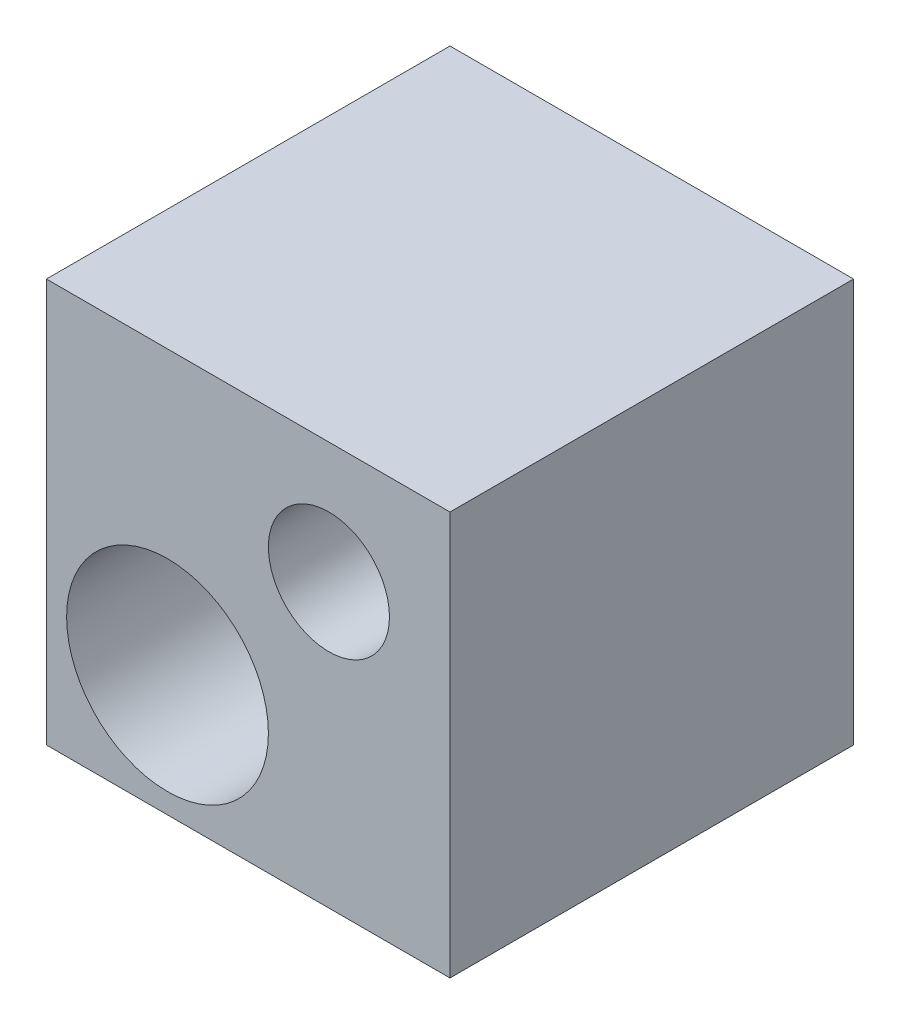
from build123d import *

# Parameters (mm, degrees)
SKETCH1_W           = 10
SKETCH1_H           = 10
BOSS_EXTRUDE1_DEPTH = 10
SKETCH2_R           = 2.5
CUT_EXTRUDE1_DEPTH  = 18.320508076
SKETCH3_R           = 1.5
CUT_EXTRUDE2_DEPTH  = 18.320508076


with BuildPart() as part:
    # Sketch1 → Boss-Extrude1 (new body)
    with BuildSketch(Plane.XY):
        with Locations((5, 5)):
            Rectangle(SKETCH1_W, SKETCH1_H)
    extrude(amount=BOSS_EXTRUDE1_DEPTH)

    # Sketch2 → Cut-Extrude1 (cut, through all)
    with BuildSketch(Plane.XY.offset(10)):
        with Locations((3, 3)):
            Circle(SKETCH2_R)
    extrude(amount=-CUT_EXTRUDE1_DEPTH, mode=Mode.SUBTRACT)

    # Sketch3 → Cut-Extrude2 (cut, through all)
    with BuildSketch(Plane.XY.offset(10)):
        with Locations((7, 7)):
            Circle(SKETCH3_R)
    extrude(amount=-CUT_EXTRUDE2_DEPTH, mode=Mode.SUBTRACT)


solid = part.part
